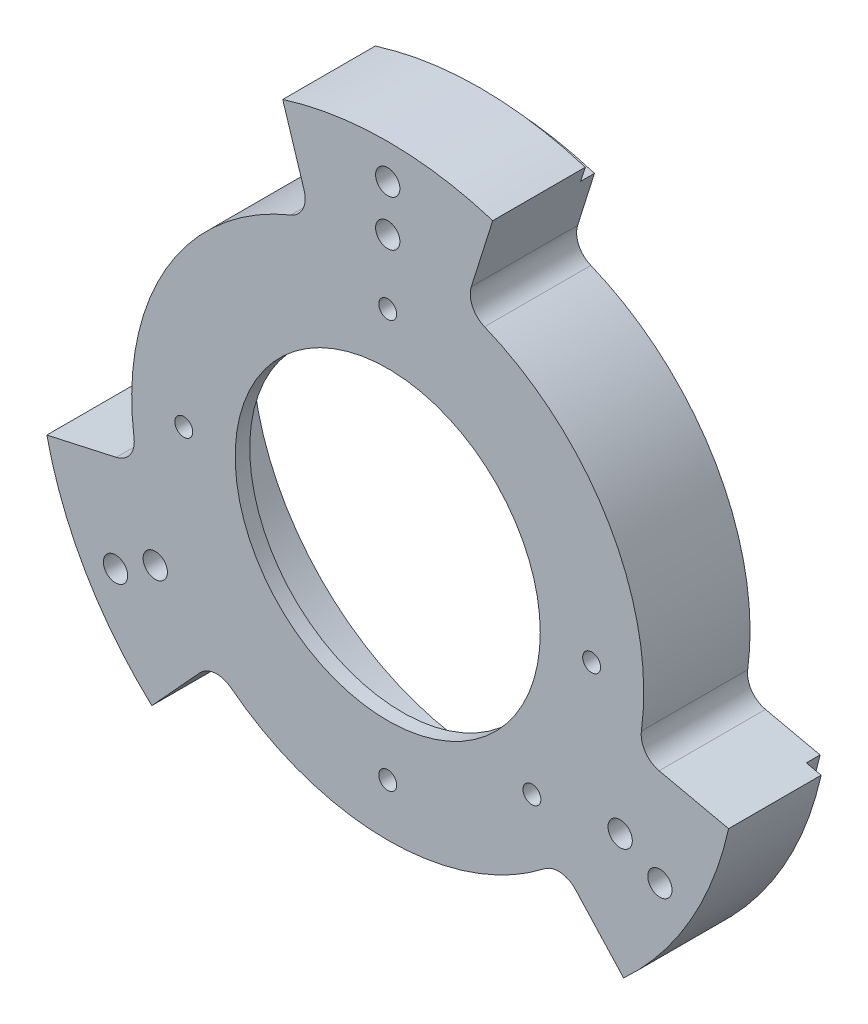
from build123d import *

# Parameters (mm, degrees)
SKETCH1_R                = 72.8
SKETCH1_R_2              = 2.065
SKETCH1_R_3              = 1.9558
SKETCH1_R_4              = 33.25
BOSS_EXTRUDE1_DEPTH      = 3.175
BOSS_EXTRUDE4_START      = 20
SKETCH14_R               = 72.8
SKETCH14_R_2             = 52.8
BOSS_EXTRUDE4_DEPTH      = 20
SKETCH15_R               = 2.065
CUT_EXTRUDE6_DEPTH       = 106.530851532
M5_CLEARANCE_HOLE1_D     = 5.3
CUT_EXTRUDE8_DEPTH       = 106.530851532
FILLET1_R                = 5
CIRPATTERN4_COUNT        = 3
FILLET1_OF_CIRPATTERN4_R = 5
BOSS_EXTRUDE8_START      = -20.175
BOSS_EXTRUDE8_DEPTH      = 30.175
CUT_EXTRUDE9_START       = -10
CUT_EXTRUDE9_DEPTH       = 10
CIRPATTERN5_COUNT        = 3


with BuildPart() as part:
    # Sketch1 → Boss-Extrude1 (new body)
    with BuildSketch(Plane.XY):
        Circle(SKETCH1_R)
        with Locations((50.662486121, -29.25)):
            Circle(SKETCH1_R_2, mode=Mode.SUBTRACT)
        with Locations((59.322740159, -34.25)):
            Circle(SKETCH1_R_2, mode=Mode.SUBTRACT)
        with Locations((-59.322740159, -34.25)):
            Circle(SKETCH1_R_2, mode=Mode.SUBTRACT)
        with Locations((-50.662486121, -29.25)):
            Circle(SKETCH1_R_2, mode=Mode.SUBTRACT)
        with Locations((0, 44.45)):
            Circle(SKETCH1_R_3, mode=Mode.SUBTRACT)
        with Locations((-44.45, 0)):
            Circle(SKETCH1_R_3, mode=Mode.SUBTRACT)
        with Locations((0, -44.45)):
            Circle(SKETCH1_R_3, mode=Mode.SUBTRACT)
        with Locations((31.430896424, -31.430896424)):
            Circle(SKETCH1_R_3, mode=Mode.SUBTRACT)
        with Locations((44.45, 0)):
            Circle(SKETCH1_R_3, mode=Mode.SUBTRACT)
        with Locations((0, 68.5)):
            Circle(SKETCH1_R_2, mode=Mode.SUBTRACT)
        with Locations((0, 58.5)):
            Circle(SKETCH1_R_2, mode=Mode.SUBTRACT)
        Circle(SKETCH1_R_4, mode=Mode.SUBTRACT)
    extrude(amount=BOSS_EXTRUDE1_DEPTH)

    # Sketch14 → Boss-Extrude4 (add)
    with BuildSketch(Plane(origin=(0, 0, 0), x_dir=(-1, 0, 0), z_dir=(0, 0, -1)).offset(BOSS_EXTRUDE4_START)):
        Circle(SKETCH14_R)
        Circle(SKETCH14_R_2, mode=Mode.SUBTRACT)
    extrude(amount=-BOSS_EXTRUDE4_DEPTH)

    # Sketch15 → Cut-Extrude6 (cut, through all)
    with BuildSketch(Plane.XY.offset(3.175)):
        with Locations((-59.322740159, -34.25)):
            Circle(SKETCH15_R)
        with Locations((-50.662486121, -29.25)):
            Circle(SKETCH15_R)
        with Locations((59.322740159, -34.25)):
            Circle(SKETCH15_R)
        with Locations((50.662486121, -29.25)):
            Circle(SKETCH15_R)
        with Locations((0, 58.5)):
            Circle(SKETCH15_R)
        with Locations((0, 68.5)):
            Circle(SKETCH15_R)
    extrude(amount=-CUT_EXTRUDE6_DEPTH, mode=Mode.SUBTRACT)

    # M5 Clearance Hole1 (through all)
    with Locations(Plane.XY.offset(3.175)):
        with Locations((0, 58.5), (0, 68.5), (50.662486121, -29.25), (59.322740159, -34.25), (-59.322740159, -34.25), (-50.662486121, -29.25)):
            Hole(M5_CLEARANCE_HOLE1_D / 2)

    # Sketch30 → Cut-Extrude8 (cut, through all)
    with BuildSketch(Plane(origin=(0, 0, -20), x_dir=(-1, 0, 0), z_dir=(0, 0, -1))):
        with BuildLine():
            ThreePointArc((-21.891382204, 69.430594014), (-63.046649396, 36.4), (-71.074349318, -15.756803895))
            Line((-71.074349318, -15.756803895), (-56.429909212, -12.510209686))
            Line((-56.429909212, -12.510209686), (-54.477317197, -12.077330458))
            ThreePointArc((-54.477317197, -12.077330458), (-48.324217531, 27.9), (-16.779383612, 53.217405852))
            Line((-16.779383612, 53.217405852), (-17.380795211, 55.124839753))
            Line((-17.380795211, 55.124839753), (-21.891382204, 69.430594014))
        make_face()
    cut_extrude8 = extrude(amount=-CUT_EXTRUDE8_DEPTH, mode=Mode.SUBTRACT)

    # Fillet1
    fillet1_edges = [part.edges().sort_by_distance(p)[0] for p in [
        (54.477317197, -12.077330458, -8.4125),
        (16.779383612, 53.217405852, -8.4125),
    ]]
    fillet(fillet1_edges, radius=FILLET1_R)

    # CirPattern4: Cut-Extrude8 ×3 about axis
    cirpattern4_axis = Axis((0, 0, 0), (0, 0, 1))
    for i in range(1, CIRPATTERN4_COUNT):
        add(cut_extrude8.rotate(cirpattern4_axis, i * 360 / CIRPATTERN4_COUNT), mode=Mode.SUBTRACT)

    # Fillet1 of CirPattern4
    fillet1_of_cirpattern4_edges = [part.edges().sort_by_distance(p)[0] for p in [
        (-16.779383612, 53.217405852, -8.4125),
        (-54.477317197, -12.077330458, -8.4125),
        (-37.697933585, -41.140075394, -8.4125),
        (37.697933585, -41.140075394, -8.4125),
    ]]
    fillet(fillet1_of_cirpattern4_edges, radius=FILLET1_OF_CIRPATTERN4_R)

    # Sketch31 → Boss-Extrude8 (add)
    with BuildSketch(Plane.XY.offset(3.175).offset(BOSS_EXTRUDE8_START)):
        with BuildLine():
            Line((21.891382204, 69.430594014), (21.816905179, 69.19438307))
            ThreePointArc((21.816905179, 69.19438307), (0, 72.552325945), (-21.816905179, 69.19438307))
            Line((-21.816905179, 69.19438307), (-22.883711342, 72.577859952))
            ThreePointArc((-22.883711342, 72.577859952), (0, 76.1), (22.883711342, 72.577859952))
            Line((22.883711342, 72.577859952), (21.891382204, 69.430594014))
        make_face()
    boss_extrude8 = extrude(amount=BOSS_EXTRUDE8_DEPTH)

    # Sketch32 → Cut-Extrude9 (cut)
    with BuildSketch(Plane.XY.offset(13.175).offset(CUT_EXTRUDE9_START)):
        with BuildLine():
            Line((21.816905179, 69.19438307), (22.883711342, 72.577859952))
            ThreePointArc((22.883711342, 72.577859952), (0, 76.1), (-22.883711342, 72.577859952))
            Line((-22.883711342, 72.577859952), (-21.816905179, 69.19438307))
            ThreePointArc((-21.816905179, 69.19438307), (0, 72.552325945), (21.816905179, 69.19438307))
        make_face()
    cut_extrude9 = extrude(amount=CUT_EXTRUDE9_DEPTH, mode=Mode.SUBTRACT)

    # CirPattern5: Boss-Extrude8, Cut-Extrude9 ×3 about axis
    cirpattern5_axis = Axis((0, 0, 0), (0, 0, 1))
    add([boss_extrude8.rotate(cirpattern5_axis, i * 360 / CIRPATTERN5_COUNT) for i in range(1, CIRPATTERN5_COUNT)])
    add([cut_extrude9.rotate(cirpattern5_axis, i * 360 / CIRPATTERN5_COUNT) for i in range(1, CIRPATTERN5_COUNT)], mode=Mode.SUBTRACT)


solid = part.part
